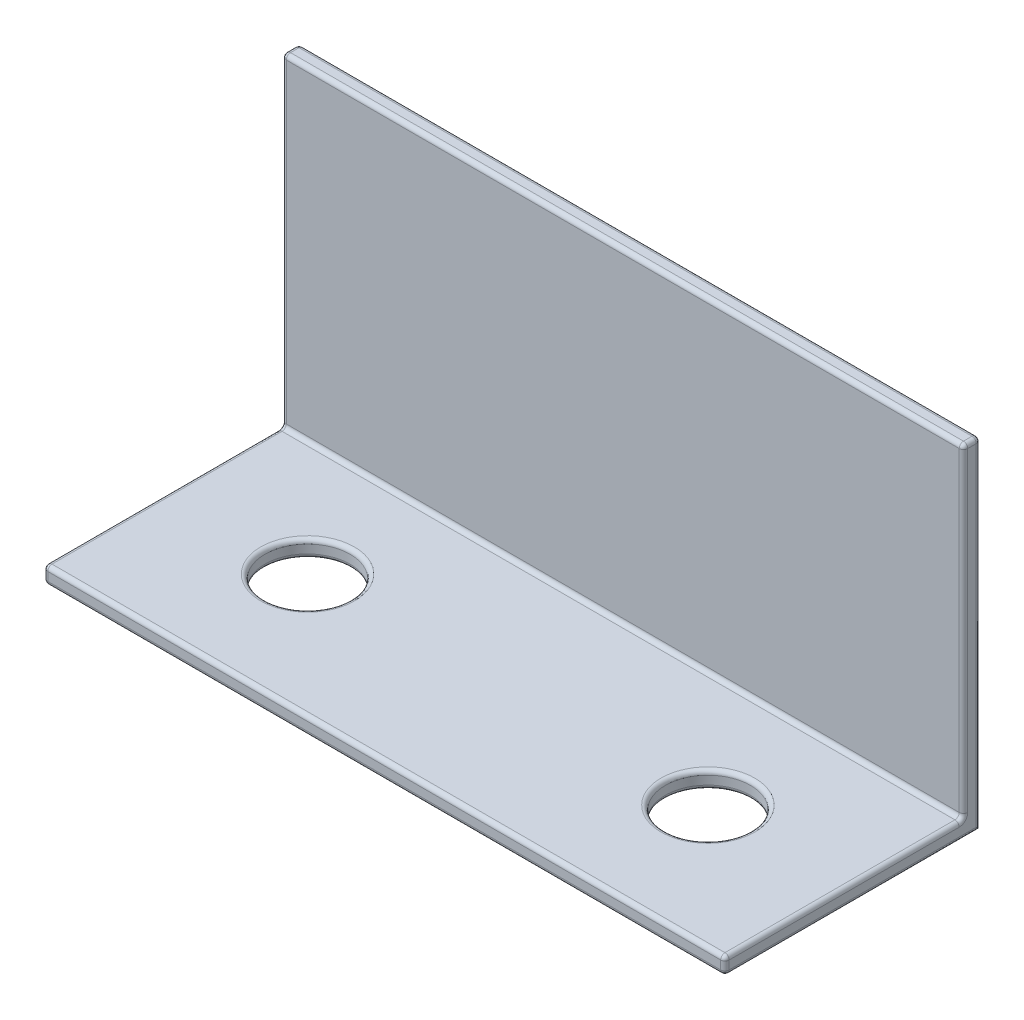
from build123d import *

# Parameters (mm, degrees)
BOSS_EXTRUDE1_DEPTH = 40
FILLET1_R           = 0.25
CUT_EXTRUDE1_REACH  = 48.755
SKETCH2_R           = 2.5
FILLET2_R           = 0.25


with BuildPart() as part:
    # Sketch1 → Boss-Extrude1 (new body)
    with BuildSketch(Plane(origin=(0, 0, 0), x_dir=(0, 0, -1), z_dir=(1, 0, 0))):
        Polygon((0, 0), (14, 0), (14, 19), (15, 19), (15, -1), (0, -1), align=None)
    extrude(amount=BOSS_EXTRUDE1_DEPTH)

    # Fillet1
    fillet1_edges = [part.edges().sort_by_distance(p)[0] for p in [
        (20, 0, 0),
        (20, 0, -14),
        (20, 19, -14),
        (20, 19, -15),
        (20, -1, 0),
        (40, 9, -15),
        (40, 19, -14.5),
        (40, 9.5, -14),
        (40, 0, -7),
        (40, -0.5, 0),
        (0, 0, -7),
        (0, 9.5, -14),
        (0, 19, -14.5),
        (0, 9, -15),
        (0, -1, -7.5),
        (0, -0.5, 0),
        (40, -1, -7.5),
    ]]
    fillet(fillet1_edges, radius=FILLET1_R)

    # Sketch2 → Cut-Extrude1 (cut, up to next)
    with BuildSketch(Plane(origin=(0, 0, 0), x_dir=(1, 0, 0), z_dir=(0, 1, 0)), mode=Mode.PRIVATE) as cut_extrude1_sk1:
        with Locations(Location((8.25, 7.25, 0), (0, 0, 270))):
            Circle(SKETCH2_R)
    cut_extrude1_tool1 = extrude(cut_extrude1_sk1.sketch, amount=-CUT_EXTRUDE1_REACH, mode=Mode.PRIVATE) & part.part
    # Sketch2 → Cut-Extrude1 (cut, up to next)
    with BuildSketch(Plane(origin=(0, 0, 0), x_dir=(1, 0, 0), z_dir=(0, 1, 0)), mode=Mode.PRIVATE) as cut_extrude1_sk2:
        with Locations(Location((31.75, 7.25, 0), (0, 0, 270))):
            Circle(SKETCH2_R)
    cut_extrude1_tool2 = extrude(cut_extrude1_sk2.sketch, amount=-CUT_EXTRUDE1_REACH, mode=Mode.PRIVATE) & part.part
    add(cut_extrude1_tool1.solids().sort_by_distance((8.25, 0, -7.25))[0], mode=Mode.SUBTRACT)
    add(cut_extrude1_tool2.solids().sort_by_distance((31.75, 0, -7.25))[0], mode=Mode.SUBTRACT)

    # Fillet2
    fillet2_edges = [part.edges().sort_by_distance(p)[0] for p in [
        (8.25, 0, -9.75),
        (8.25, -1, -9.75),
        (31.75, 0, -9.75),
        (31.75, -1, -9.75),
    ]]
    fillet(fillet2_edges, radius=FILLET2_R)


solid = part.part
